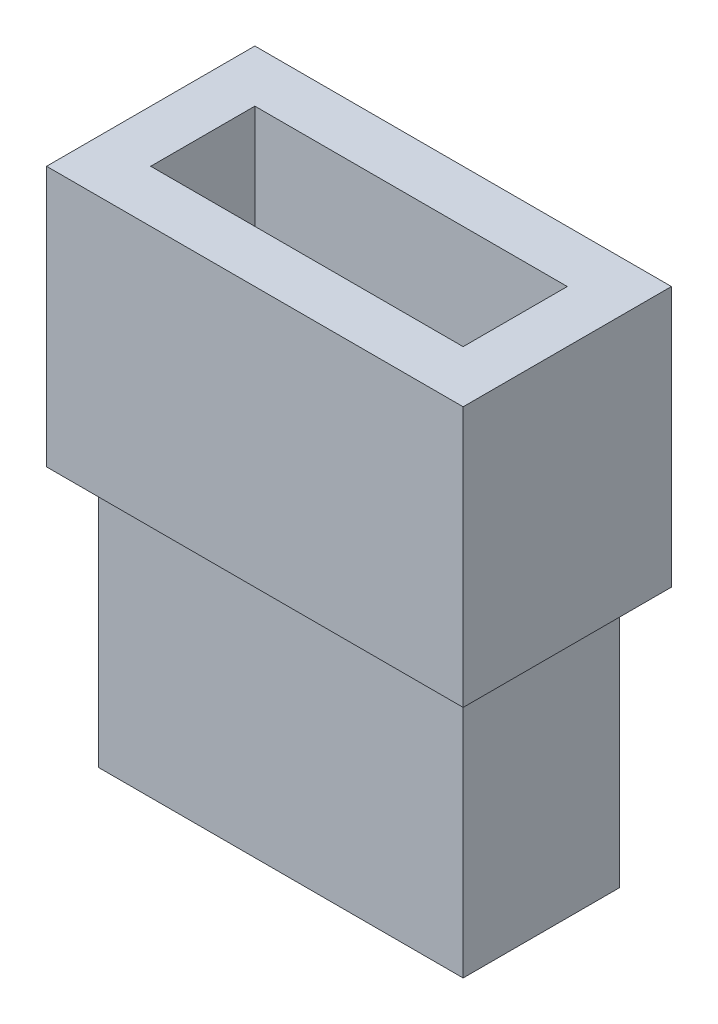
from build123d import *

# Parameters (mm, degrees)
SKETCH1_W           = 40
SKETCH1_H           = 20
SKETCH1_W_2         = 30
SKETCH1_H_2         = 10
BOSS_EXTRUDE1_DEPTH = 25
SKETCH1_3_W         = 35
SKETCH1_3_H         = 15
SKETCH1_3_W_2       = 30
SKETCH1_3_H_2       = 10
BOSS_EXTRUDE2_DEPTH = 25


with BuildPart() as part:
    # Sketch1 → Boss-Extrude1 (new body)
    with BuildSketch(Plane(origin=(0, 0, 0), x_dir=(1, 0, 0), z_dir=(0, 1, 0))):
        Rectangle(SKETCH1_W, SKETCH1_H)
        Rectangle(SKETCH1_W_2, SKETCH1_H_2, mode=Mode.SUBTRACT)
    extrude(amount=BOSS_EXTRUDE1_DEPTH)

    # Sketch1<3> → Boss-Extrude2 (add)
    with BuildSketch(Plane(origin=(0, 0, 0), x_dir=(1, 0, 0), z_dir=(0, 1, 0))):
        Rectangle(SKETCH1_3_W, SKETCH1_3_H)
        Rectangle(SKETCH1_3_W_2, SKETCH1_3_H_2, mode=Mode.SUBTRACT)
    extrude(amount=-BOSS_EXTRUDE2_DEPTH)


solid = part.part
